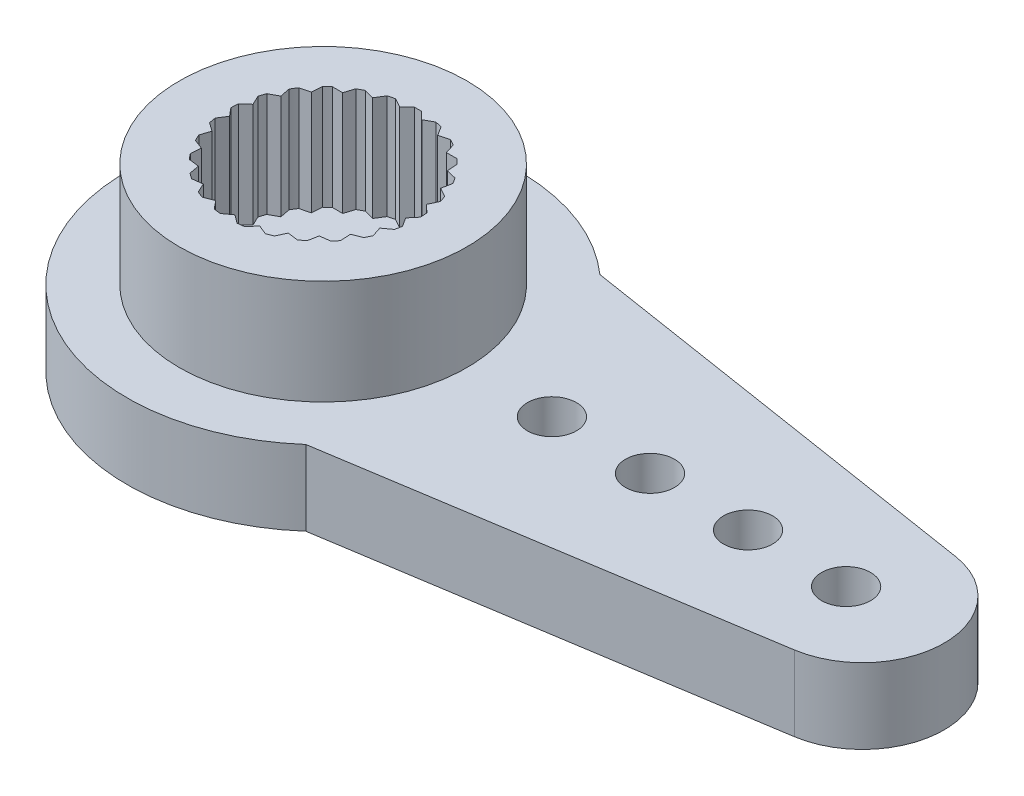
from build123d import *

# Parameters (mm, degrees)
SKETCH2_R           = 6
SKETCH2_R_2         = 1.5
BOSS_EXTRUDE1_DEPTH = 1.15
SKETCH3_R           = 4.4
BOSS_EXTRUDE2_DEPTH = 3.2
SKETCH4_R           = 0.75
BOSS_EXTRUDE3_DEPTH = 1.15


with BuildPart() as part:
    # Sketch2 → Boss-Extrude1 (new, symmetric)
    with BuildSketch(Plane(origin=(0, 0, 0), x_dir=(1, 0, 0), z_dir=(0, 1, 0))):
        with Locations(Location((0, 0, 0), (0, 0, 270))):
            Circle(SKETCH2_R)
        with Locations(Location((0, 0, 0), (0, 0, 270))):
            Circle(SKETCH2_R_2, mode=Mode.SUBTRACT)
    extrude(amount=BOSS_EXTRUDE1_DEPTH, both=True)

    # Sketch3 → Boss-Extrude2 (add)
    with BuildSketch(Plane(origin=(0, 1.15, 0), x_dir=(1, 0, 0), z_dir=(0, 1, 0))):
        with Locations(Location((0, 0, 0), (0, 0, 270))):
            Circle(SKETCH3_R)
        with BuildLine():
            Line((0.107421435, 2.898009771), (0.338399731, 2.678709694))
            Line((0.338399731, 2.678709694), (0.61665913, 2.83367809))
            ThreePointArc((0.61665913, 2.83367809), (0.721200673, 2.808891167), (0.824752316, 2.780248841))
            Line((0.824752316, 2.780248841), (0.993936292, 2.510396512))
            Line((0.993936292, 2.510396512), (1.301992734, 2.591295993))
            ThreePointArc((1.301992734, 2.591295993), (1.397085655, 2.541289372), (1.490260976, 2.48779465))
            Line((1.490260976, 2.48779465), (1.587020181, 2.184345885))
            Line((1.587020181, 2.184345885), (1.905517346, 2.186093238))
            ThreePointArc((1.905517346, 2.186093238), (1.985186607, 2.11400902), (2.062131058, 2.039023173))
            Line((2.062131058, 2.039023173), (2.080385755, 1.721044772))
            Line((2.080385755, 1.721044772), (2.389311295, 1.643530205))
            ThreePointArc((2.389311295, 1.643530205), (2.448550984, 1.553897705), (2.504429862, 1.46213237))
            Line((2.504429862, 1.46213237), (2.443033042, 1.149604087))
            Line((2.443033042, 1.149604087), (2.722976028, 0.997698125))
            ThreePointArc((2.722976028, 0.997698125), (2.758063897, 0.896149284), (2.789366126, 0.793370413))
            Line((2.789366126, 0.793370413), (2.652175577, 0.505929549))
            Line((2.652175577, 0.505929549), (2.885546163, 0.289177003))
            ThreePointArc((2.885546163, 0.289177003), (2.894277512, 0.182092507), (2.899036259, 0.074758075))
            Line((2.899036259, 0.074758075), (2.694672167, -0.169534403))
            Line((2.694672167, -0.169534403), (2.866806821, -0.437514174))
            ThreePointArc((2.866806821, -0.437514174), (2.848633027, -0.543405812), (2.826549281, -0.648551587))
            Line((2.826549281, -0.648551587), (2.567852594, -0.834345885))
            Line((2.567852594, -0.834345885), (2.667935462, -1.136714727))
            ThreePointArc((2.667935462, -1.136714727), (2.623998452, -1.234759946), (2.576459817, -1.331110368))
            Line((2.576459817, -1.331110368), (2.279685399, -1.446732346))
            Line((2.279685399, -1.446732346), (2.301427906, -1.764491312))
            ThreePointArc((2.301427906, -1.764491312), (2.234488404, -1.84852957), (2.164481907, -1.930030589))
            Line((2.164481907, -1.930030589), (1.848277186, -1.968215294))
            Line((1.848277186, -1.968215294), (1.790313171, -2.281398419))
            ThreePointArc((1.790313171, -2.281398419), (1.704577232, -2.346149284), (1.616501638, -2.40767989))
            Line((1.616501638, -2.40767989), (1.30073492, -2.366028036))
            Line((1.30073492, -2.366028036), (1.166706475, -2.654956874))
            ThreePointArc((1.166706475, -2.654956874), (1.067561203, -2.696351809), (0.966950626, -2.734045809))
            Line((0.966950626, -2.734045809), (0.671462695, -2.615174535))
            Line((0.671462695, -2.615174535), (0.469791321, -2.861694623))
            ThreePointArc((0.469791321, -2.861694623), (0.363466377, -2.877132634), (0.25664255, -2.888621575))
            Line((0.25664255, -2.888621575), (0, -2.7))
            Line((0, -2.7), (-0.25664255, -2.888621575))
            ThreePointArc((-0.25664255, -2.888621575), (-0.363466377, -2.877132634), (-0.469791321, -2.861694623))
            Line((-0.469791321, -2.861694623), (-0.671462695, -2.615174535))
            Line((-0.671462695, -2.615174535), (-0.966950626, -2.734045809))
            ThreePointArc((-0.966950626, -2.734045809), (-1.067561203, -2.696351809), (-1.166706475, -2.654956874))
            Line((-1.166706475, -2.654956874), (-1.30073492, -2.366028036))
            Line((-1.30073492, -2.366028036), (-1.616501638, -2.40767989))
            ThreePointArc((-1.616501638, -2.40767989), (-1.704577232, -2.346149284), (-1.790313171, -2.281398419))
            Line((-1.790313171, -2.281398419), (-1.848277186, -1.968215294))
            Line((-1.848277186, -1.968215294), (-2.164481907, -1.930030589))
            ThreePointArc((-2.164481907, -1.930030589), (-2.234488404, -1.84852957), (-2.301427906, -1.764491312))
            Line((-2.301427906, -1.764491312), (-2.279685399, -1.446732346))
            Line((-2.279685399, -1.446732346), (-2.576459817, -1.331110368))
            ThreePointArc((-2.576459817, -1.331110368), (-2.623998452, -1.234759946), (-2.667935462, -1.136714727))
            Line((-2.667935462, -1.136714727), (-2.567852594, -0.834345885))
            Line((-2.567852594, -0.834345885), (-2.826549281, -0.648551587))
            ThreePointArc((-2.826549281, -0.648551587), (-2.848633027, -0.543405812), (-2.866806821, -0.437514174))
            Line((-2.866806821, -0.437514174), (-2.694672167, -0.169534403))
            Line((-2.694672167, -0.169534403), (-2.899036259, 0.074758075))
            ThreePointArc((-2.899036259, 0.074758075), (-2.894277512, 0.182092507), (-2.885546163, 0.289177003))
            Line((-2.885546163, 0.289177003), (-2.652175577, 0.505929549))
            Line((-2.652175577, 0.505929549), (-2.789366126, 0.793370413))
            ThreePointArc((-2.789366126, 0.793370413), (-2.758063897, 0.896149284), (-2.722976028, 0.997698125))
            Line((-2.722976028, 0.997698125), (-2.443033042, 1.149604087))
            Line((-2.443033042, 1.149604087), (-2.504429862, 1.46213237))
            ThreePointArc((-2.504429862, 1.46213237), (-2.448550984, 1.553897705), (-2.389311295, 1.643530205))
            Line((-2.389311295, 1.643530205), (-2.080385755, 1.721044772))
            Line((-2.080385755, 1.721044772), (-2.062131058, 2.039023173))
            ThreePointArc((-2.062131058, 2.039023173), (-1.985186607, 2.11400902), (-1.905517346, 2.186093238))
            Line((-1.905517346, 2.186093238), (-1.587020181, 2.184345885))
            Line((-1.587020181, 2.184345885), (-1.490260976, 2.48779465))
            ThreePointArc((-1.490260976, 2.48779465), (-1.397085655, 2.541289372), (-1.301992734, 2.591295993))
            Line((-1.301992734, 2.591295993), (-0.993936292, 2.510396512))
            Line((-0.993936292, 2.510396512), (-0.824752316, 2.780248841))
            ThreePointArc((-0.824752316, 2.780248841), (-0.721200673, 2.808891167), (-0.61665913, 2.83367809))
            Line((-0.61665913, 2.83367809), (-0.338399731, 2.678709694))
            Line((-0.338399731, 2.678709694), (-0.107421435, 2.898009771))
            ThreePointArc((-0.107421435, 2.898009771), (0, 2.9), (0.107421435, 2.898009771))
        make_face(mode=Mode.SUBTRACT)
    extrude(amount=BOSS_EXTRUDE2_DEPTH)

    # Sketch4 → Boss-Extrude3 (add, symmetric)
    with BuildSketch(Plane(origin=(0, 0, 0), x_dir=(1, 0, 0), z_dir=(0, 1, 0))):
        with BuildLine():
            Line((3.968626967, 4.5), (16.888114198, 2.469689731))
            ThreePointArc((16.888114198, 2.469689731), (19, 0), (16.888114198, -2.469689731))
            Line((16.888114198, -2.469689731), (3.968626967, -4.5))
            ThreePointArc((3.968626967, -4.5), (6, 0), (3.968626967, 4.5))
        make_face()
        with Locations(Location((16, 0, 0), (0, 0, 270))):
            Circle(SKETCH4_R, mode=Mode.SUBTRACT)
        with Locations(Location((13, 0, 0), (0, 0, 270))):
            Circle(SKETCH4_R, mode=Mode.SUBTRACT)
        with Locations(Location((10, 0, 0), (0, 0, 270))):
            Circle(SKETCH4_R, mode=Mode.SUBTRACT)
        with Locations(Location((7, 0, 0), (0, 0, 270))):
            Circle(SKETCH4_R, mode=Mode.SUBTRACT)
    extrude(amount=BOSS_EXTRUDE3_DEPTH, both=True)


solid = part.part
